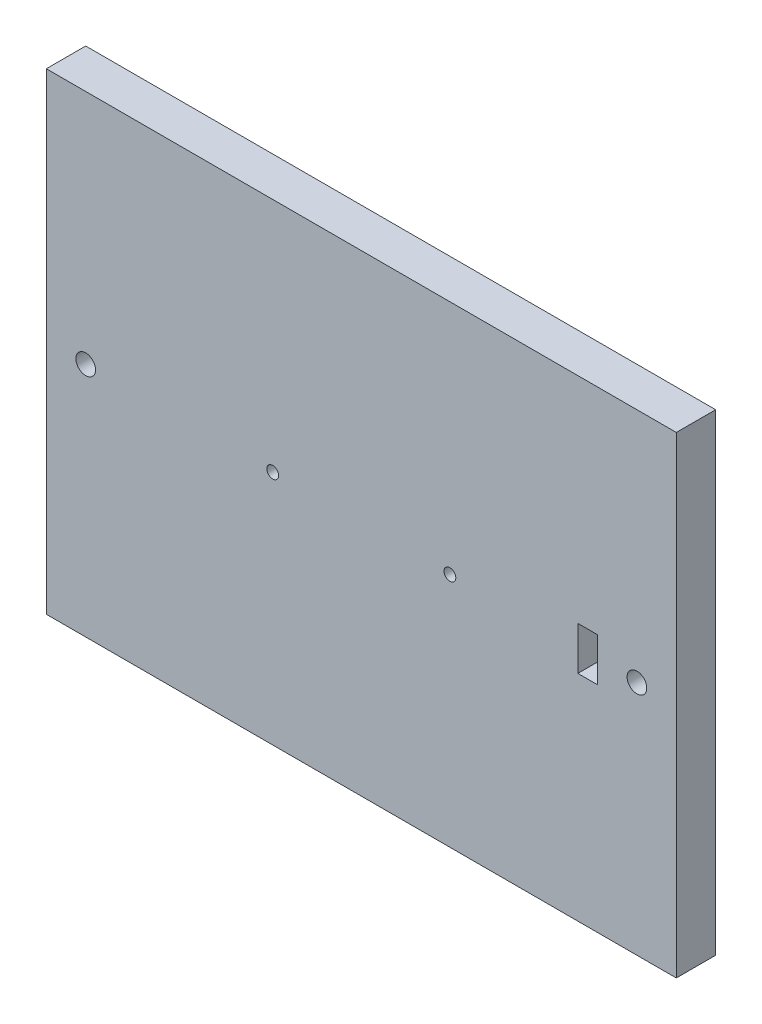
from build123d import *

# Parameters (mm, degrees)
SKETCH1_W           = 160
SKETCH1_H           = 120
BOSS_EXTRUDE1_DEPTH = 10
SKETCH2_R           = 1.5
SKETCH2_R_2         = 2.5
SKETCH2_W           = 5
SKETCH2_H           = 11
CUT_EXTRUDE2_DEPTH  = 101.498756211
SKETCH3_W           = 10
SKETCH3_H           = 10
CUT_EXTRUDE3_DEPTH  = 4
SKETCH4_W           = 90
SKETCH4_H           = 3
BOSS_EXTRUDE3_DEPTH = 25.05
CUT_EXTRUDE5_DEPTH  = 112.819061434


with BuildPart() as part:
    # Sketch1 → Boss-Extrude1 (new body)
    with BuildSketch(Plane.XY):
        Rectangle(SKETCH1_W, SKETCH1_H)
    extrude(amount=BOSS_EXTRUDE1_DEPTH)

    # Sketch2 → Cut-Extrude2 (cut, through all)
    with BuildSketch(Plane(origin=(0, 0, 0), x_dir=(-1, 0, 0), z_dir=(0, 0, -1))):
        with Locations((-22.5, 0)):
            Circle(SKETCH2_R)
        with Locations((22.5, 0)):
            Circle(SKETCH2_R)
        with Locations((70, 0)):
            Circle(SKETCH2_R_2)
        with Locations((-70, 0)):
            Circle(SKETCH2_R_2)
        with Locations((-57.5, 0)):
            Rectangle(SKETCH2_W, SKETCH2_H)
    extrude(amount=-CUT_EXTRUDE2_DEPTH, mode=Mode.SUBTRACT)

    # Sketch3 → Cut-Extrude3 (cut)
    with BuildSketch(Plane(origin=(0, 0, 0), x_dir=(-1, 0, 0), z_dir=(0, 0, -1))):
        with Locations((-70, 0)):
            Rectangle(SKETCH3_W, SKETCH3_H)
        with Locations((70, 0)):
            Rectangle(SKETCH3_W, SKETCH3_H)
    extrude(amount=-CUT_EXTRUDE3_DEPTH, mode=Mode.SUBTRACT)

    # Sketch4 → Boss-Extrude3 (add)
    with BuildSketch(Plane(origin=(0, 0, 0), x_dir=(-1, 0, 0), z_dir=(0, 0, -1))):
        with Locations((0, -12.5)):
            Rectangle(SKETCH4_W, SKETCH4_H)
    extrude(amount=BOSS_EXTRUDE3_DEPTH)

    # Sketch5 → Cut-Extrude5 (cut, through all)
    with BuildSketch(Plane.XZ.offset(14)):
        with BuildLine():
            Line((3.2, -19.325), (3.2, -5.725))
            ThreePointArc((3.2, -5.725), (0, -2.525), (-3.2, -5.725))
            Line((-3.2, -5.725), (-3.2, -19.325))
            ThreePointArc((-3.2, -19.325), (0, -22.525), (3.2, -19.325))
        make_face()
    extrude(amount=-CUT_EXTRUDE5_DEPTH, mode=Mode.SUBTRACT)


solid = part.part
